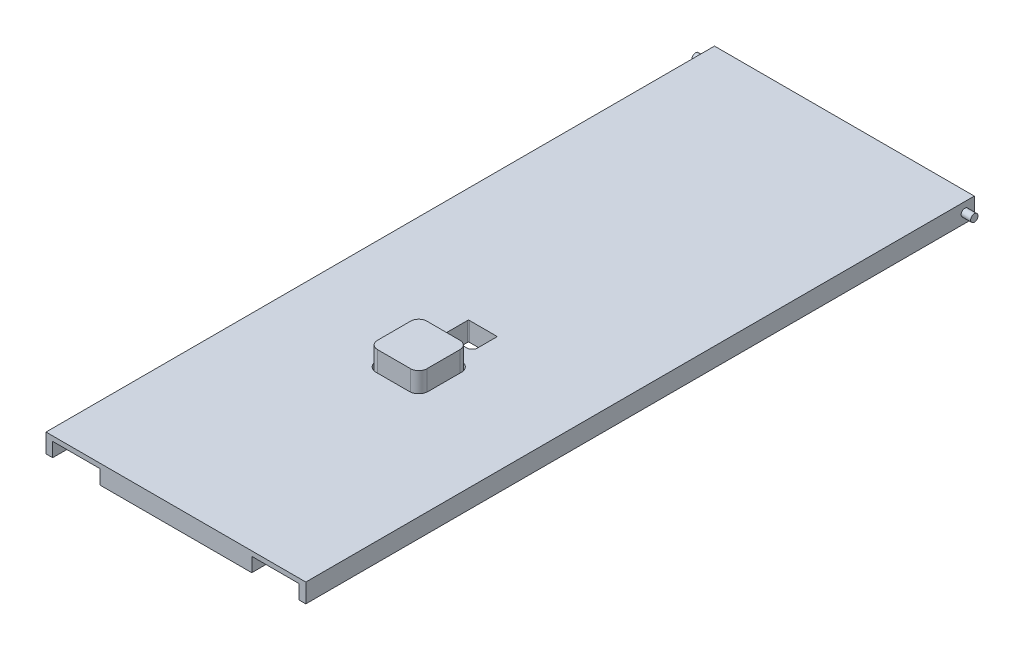
from build123d import *

# Parameters (mm, degrees)
SKETCH_1_W          = 27.4
SKETCH_1_H          = 2
EXTRUDE_1_DEPTH     = 70.5
CUT_EXTRUDE_5_DEPTH = 2.5
FILLET_4_R          = 0.1
SKETCH_14_R         = 0.39
EXTRUDE_7_DEPTH     = 1
EXTRUDE_START       = 1
SKETCH_15_R         = 0.39
EXTRUDE_8_DEPTH     = 1
SKETCH_16_W         = 5
SKETCH_16_H         = 1.5
CUT_EXTRUDE_6_DEPTH = 5
SKETCH_4_W          = 5.5
SKETCH_4_H          = 5.5
CUT_EXTRUDE_2_DEPTH = 73.044014325
FILLET_1_R          = 1
EXTRUDE_3_DEPTH     = 4
SKETCH_6_R          = 0.9
EXTRUDE_4_DEPTH     = 2
SKETCH_7_R          = 0.75
EXTRUDE_5_DEPTH     = 4.5
EXTRUDE_START_2     = 2
EXTRUDE_6_DEPTH     = 3
CUT_EXTRUDE_7_DEPTH = 2


with BuildPart() as part:
    # 草图1 → 凸台-拉伸1 (new body)
    with BuildSketch(Plane.XY):
        with Locations((0, 1)):
            Rectangle(SKETCH_1_W, SKETCH_1_H)
    extrude(amount=EXTRUDE_1_DEPTH)

    # 草图13 → 切除-拉伸5 (cut, symmetric)
    with BuildSketch(Plane(origin=(0, 0, 0), x_dir=(0, 0, -1), z_dir=(1, 0, 0))):
        with BuildLine():
            Line((-68.5, 0), (-67.150174859, 0))
            Line((-67.150174859, 0), (-67.150174859, 1.65))
            Line((-67.150174859, 1.65), (-68.65, 1.65))
            ThreePointArc((-68.65, 1.65), (-69.283184792, 1.146891183), (-68.936182348, 0.41639083))
            Line((-68.936182348, 0.41639083), (-68.936182348, 0))
            Line((-68.936182348, 0), (-68.5, 0))
        make_face()
    extrude(amount=CUT_EXTRUDE_5_DEPTH, both=True, mode=Mode.SUBTRACT)

    # 圆角4
    fillet_4_edges = [part.edges().sort_by_distance(p)[0] for p in [
        (0, 0, 68.936182348),
    ]]
    fillet(fillet_4_edges, radius=FILLET_4_R)

    # 草图14 → 凸台-拉伸7 (add)
    with BuildSketch(Plane.ZY.offset(13.7)):
        with Locations(Location((1, 1, 0), (0, 0, 90))):
            Circle(SKETCH_14_R)
    extrude(amount=EXTRUDE_7_DEPTH)

    # 草图15 → 凸台-拉伸8 (add)
    with BuildSketch(Plane(origin=(13.7, 0, 0), x_dir=(0, 0, -1), z_dir=(1, 0, 0)).offset(EXTRUDE_START)):
        with Locations(Location((-1, 1, 0), (0, 0, 90))):
            Circle(SKETCH_15_R)
    extrude(amount=-EXTRUDE_8_DEPTH)

    # 草图16 → 切除-拉伸6 (cut)
    with BuildSketch(Plane.XY.offset(70.5)):
        with Locations((-10.5, 0.75)):
            Rectangle(SKETCH_16_W, SKETCH_16_H)
        with Locations((10.5, 0.75)):
            Rectangle(SKETCH_16_W, SKETCH_16_H)
    extrude(amount=-CUT_EXTRUDE_6_DEPTH, mode=Mode.SUBTRACT)

    # 草图4 → 切除-拉伸2 (cut, through all)
    with BuildSketch(Plane(origin=(0, 2, 0), x_dir=(1, 0, 0), z_dir=(0, 1, 0))):
        with Locations((-0.000254001, -44.890957582)):
            Rectangle(SKETCH_4_W, SKETCH_4_H)
    extrude(amount=-CUT_EXTRUDE_2_DEPTH, mode=Mode.SUBTRACT)

    # 圆角1
    fillet_1_edges = [part.edges().sort_by_distance(p)[0] for p in [
        (2.749745999, 1, 42.140957582),
        (2.749745999, 1, 47.640957582),
        (-2.750254001, 1, 47.640957582),
        (-2.750254001, 1, 42.140957582),
    ]]
    fillet(fillet_1_edges, radius=FILLET_1_R)

    # 草图7 → 凸台-拉伸5 (add)
    with BuildSketch(Plane.XZ):
        with Locations(Location((4.199745999, 44.890957582, 0), (0, 0, 180))):
            Circle(SKETCH_7_R)
        with Locations(Location((-4.200254001, 44.890957582, 0), (0, 0, 180))):
            Circle(SKETCH_7_R)
    extrude(amount=EXTRUDE_5_DEPTH)

    # 草图17 → 切除-拉伸7 (cut)
    with BuildSketch(Plane(origin=(0, 2, 0), x_dir=(1, 0, 0), z_dir=(0, 1, 0))):
        with BuildLine():
            Line((1.381293223, -40.281381402), (1.381293223, -38.081000872))
            add(Edge.make_bspline(
                [(1.381293223, -38.081000872), (1.381293223, -37.981381402), (1.281673753, -37.981381402)],
                knots=[5.501585242, 5.501585242, 5.501585242, 7.064785372, 7.064785372, 7.064785372], degree=2, weights=[1, 0.709787336, 1]))
            Line((1.281673753, -37.981381402), (-1.561607713, -37.981381402))
            add(Edge.make_bspline(
                [(-1.561607713, -37.981381402), (-1.661227183, -37.981381402), (-1.661227183, -38.081000872)],
                knots=[5.501585242, 5.501585242, 5.501585242, 7.064785372, 7.064785372, 7.064785372], degree=2, weights=[1, 0.709787336, 1]))
            Line((-1.661227183, -38.081000872), (-1.661227183, -40.524282338))
            add(Edge.make_bspline(
                [(-1.661227183, -40.524282338), (-1.661227183, -40.623901808), (-1.561607713, -40.623901808)],
                knots=[5.501585242, 5.501585242, 5.501585242, 7.064785372, 7.064785372, 7.064785372], degree=2, weights=[1, 0.709787336, 1]))
            Line((-1.561607713, -40.623901808), (1.038772817, -40.623901808))
            Line((1.038772817, -40.623901808), (1.381293223, -40.281381402))
        make_face()
    extrude(amount=-CUT_EXTRUDE_7_DEPTH, mode=Mode.SUBTRACT)


with BuildPart() as body_2:
    # 草图5 → 凸台-拉伸3 (new body)
    with BuildSketch(Plane.XZ):
        with BuildLine():
            Line((-2.600254001, 46.640957582), (-2.600254001, 43.140957582))
            ThreePointArc((-2.600254001, 43.140957582), (-2.351294765, 42.539916818), (-1.750254001, 42.290957582))
            Line((-1.750254001, 42.290957582), (1.749745999, 42.290957582))
            ThreePointArc((1.749745999, 42.290957582), (2.350786764, 42.539916818), (2.599745999, 43.140957582))
            Line((2.599745999, 43.140957582), (2.599745999, 46.640957582))
            ThreePointArc((2.599745999, 46.640957582), (2.350786764, 47.241998346), (1.749745999, 47.490957582))
            Line((1.749745999, 47.490957582), (-1.750254001, 47.490957582))
            ThreePointArc((-1.750254001, 47.490957582), (-2.351294765, 47.241998346), (-2.600254001, 46.640957582))
        make_face()
    extrude(amount=-EXTRUDE_3_DEPTH)

    # 草图6 → 凸台-拉伸4 (add)
    # profile 1 of 3: a face of its own
    with BuildSketch(Plane.XZ):
        with BuildLine():
            ThreePointArc((-2.600254001, 46.640957582), (-2.459343486, 47.109670821), (-2.08333141, 47.422980241))
            Line((-2.08333141, 47.422980241), (-4.788037664, 46.270997568))
            ThreePointArc((-4.788037664, 46.270997568), (-5.700254001, 44.890957582), (-4.788037664, 43.510917595))
            Line((-4.788037664, 43.510917595), (-2.08333141, 42.358934923))
            ThreePointArc((-2.08333141, 42.358934923), (-2.459343486, 42.672244342), (-2.600254001, 43.140957582))
            Line((-2.600254001, 43.140957582), (-2.600254001, 46.640957582))
        make_face()
        with Locations(Location((-4.200254001, 44.890957582, 0), (0, 0, 270))):
            Circle(SKETCH_6_R, mode=Mode.SUBTRACT)
    # profile 2 of 3: a face of its own
    with BuildSketch(Plane.XZ):
        with BuildLine():
            Line((1.749745999, 47.490957582), (-1.750254001, 47.490957582))
            ThreePointArc((-1.750254001, 47.490957582), (-2.351294765, 47.241998346), (-2.600254001, 46.640957582))
            Line((-2.600254001, 46.640957582), (-2.600254001, 43.140957582))
            ThreePointArc((-2.600254001, 43.140957582), (-2.351294765, 42.539916818), (-1.750254001, 42.290957582))
            Line((-1.750254001, 42.290957582), (1.749745999, 42.290957582))
            ThreePointArc((1.749745999, 42.290957582), (2.350786764, 42.539916818), (2.599745999, 43.140957582))
            Line((2.599745999, 43.140957582), (2.599745999, 46.640957582))
            ThreePointArc((2.599745999, 46.640957582), (2.350786764, 47.241998346), (1.749745999, 47.490957582))
        make_face()
    # profile 3 of 3: a face of its own
    with BuildSketch(Plane.XZ):
        with BuildLine():
            Line((4.787529663, 46.270997568), (2.082823409, 47.422980241))
            ThreePointArc((2.082823409, 47.422980241), (2.458835485, 47.109670821), (2.599745999, 46.640957582))
            Line((2.599745999, 46.640957582), (2.599745999, 43.140957582))
            ThreePointArc((2.599745999, 43.140957582), (2.458835485, 42.672244342), (2.082823409, 42.358934923))
            Line((2.082823409, 42.358934923), (4.787529663, 43.510917595))
            ThreePointArc((4.787529663, 43.510917595), (5.699745999, 44.890957582), (4.787529663, 46.270997568))
        make_face()
        with Locations(Location((4.199745999, 44.890957582, 0), (0, 0, 270))):
            Circle(SKETCH_6_R, mode=Mode.SUBTRACT)
    extrude(amount=EXTRUDE_4_DEPTH)

    # 草图6<3> → 凸台-拉伸6 (add)
    with BuildSketch(Plane.XZ.offset(EXTRUDE_START_2)):
        with BuildLine():
            ThreePointArc((-1.750254001, 47.490957582), (-1.920225674, 47.473789876), (-2.08333141, 47.422980241))
            ThreePointArc((-2.08333141, 47.422980241), (-2.459343486, 47.109670821), (-2.600254001, 46.640957582))
            Line((-2.600254001, 46.640957582), (-2.600254001, 43.140957582))
            ThreePointArc((-2.600254001, 43.140957582), (-2.459343486, 42.672244342), (-2.08333141, 42.358934923))
            ThreePointArc((-2.08333141, 42.358934923), (-1.920225674, 42.308125288), (-1.750254001, 42.290957582))
            Line((-1.750254001, 42.290957582), (1.749745999, 42.290957582))
            ThreePointArc((1.749745999, 42.290957582), (1.919717673, 42.308125288), (2.082823409, 42.358934923))
            ThreePointArc((2.082823409, 42.358934923), (2.458835485, 42.672244342), (2.599745999, 43.140957582))
            Line((2.599745999, 43.140957582), (2.599745999, 46.640957582))
            ThreePointArc((2.599745999, 46.640957582), (2.458835485, 47.109670821), (2.082823409, 47.422980241))
            ThreePointArc((2.082823409, 47.422980241), (1.919717673, 47.473789876), (1.749745999, 47.490957582))
            Line((1.749745999, 47.490957582), (-1.750254001, 47.490957582))
        make_face()
    extrude(amount=EXTRUDE_6_DEPTH)


solid = Compound([part.part, body_2.part])
